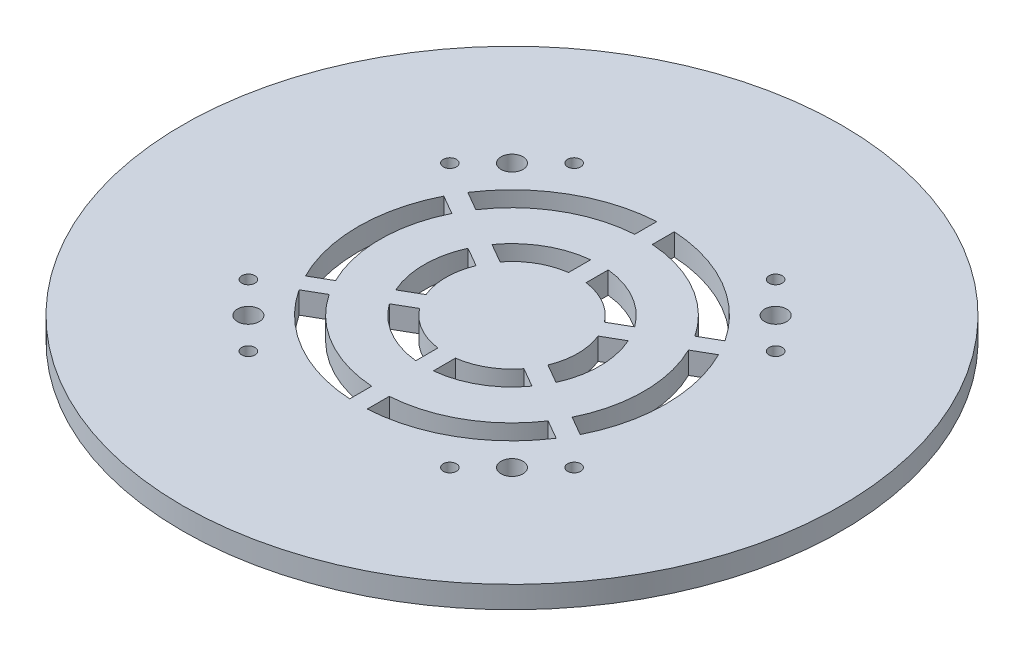
from build123d import *

# Parameters (mm, degrees)
SKETCH1_R           = 75
BOSS_EXTRUDE1_DEPTH = 5
SKETCH2_R           = 2.5
SKETCH2_R_2         = 1.5
CUT_EXTRUDE1_DEPTH  = 5
SKETCH3_R           = 35
SKETCH3_R_2         = 30
SKETCH3_R_3         = 20
SKETCH3_R_4         = 15
CUT_EXTRUDE3_DEPTH  = 5
SKETCH4_W           = 4
SKETCH4_H           = 72.786785362
BOSS_EXTRUDE2_DEPTH = 5
CIRPATTERN1_COUNT   = 6


with BuildPart() as part:
    # Sketch1 → Boss-Extrude1 (new body)
    with BuildSketch(Plane(origin=(0, 0, 0), x_dir=(1, 0, 0), z_dir=(0, 1, 0))):
        Circle(SKETCH1_R)
    extrude(amount=BOSS_EXTRUDE1_DEPTH)

    # Sketch2 → Cut-Extrude1 (cut)
    with BuildSketch(Plane(origin=(0, 5, 0), x_dir=(1, 0, 0), z_dir=(0, 1, 0))):
        with Locations((-29.999005192, 29.999005192)):
            Circle(SKETCH2_R)
        with Locations((29.999005192, 29.999005192)):
            Circle(SKETCH2_R)
        with Locations((29.999005192, -29.999005192)):
            Circle(SKETCH2_R)
        with Locations((-29.999005192, -29.999005192)):
            Circle(SKETCH2_R)
        with Locations((-22.92793738, 37.070073004)):
            Circle(SKETCH2_R_2)
        with Locations((-37.070073004, 22.92793738)):
            Circle(SKETCH2_R_2)
        with Locations((22.92793738, 37.070073004)):
            Circle(SKETCH2_R_2)
        with Locations((37.070073004, 22.92793738)):
            Circle(SKETCH2_R_2)
        with Locations((-37.070073004, -22.92793738)):
            Circle(SKETCH2_R_2)
        with Locations((-22.92793738, -37.070073004)):
            Circle(SKETCH2_R_2)
        with Locations((22.92793738, -37.070073004)):
            Circle(SKETCH2_R_2)
        with Locations((37.070073004, -22.92793738)):
            Circle(SKETCH2_R_2)
    extrude(amount=-CUT_EXTRUDE1_DEPTH, mode=Mode.SUBTRACT)

    # Sketch3 → Cut-Extrude3 (cut)
    # profile 1 of 2: a face of its own
    with BuildSketch(Plane(origin=(0, 5, 0), x_dir=(1, 0, 0), z_dir=(0, 1, 0))):
        Circle(SKETCH3_R)
        Circle(SKETCH3_R_2, mode=Mode.SUBTRACT)
    # profile 2 of 2: a face of its own
    with BuildSketch(Plane(origin=(0, 5, 0), x_dir=(1, 0, 0), z_dir=(0, 1, 0))):
        Circle(SKETCH3_R_3)
        Circle(SKETCH3_R_4, mode=Mode.SUBTRACT)
    extrude(amount=-CUT_EXTRUDE3_DEPTH, mode=Mode.SUBTRACT)


with BuildPart() as cut_extrude3_piece_1:
    # of the separate pieces the step leaves, piece 1, a body of its own (cut_extrude3_pieces)
    add(part.part.solids().sort_by_distance((75, 0, 0))[0])



with BuildPart() as cut_extrude3_piece_2:
    # of the separate pieces the step leaves, piece 2, a body of its own (cut_extrude3_pieces)
    add(part.part.solids().sort_by_distance((30, 0, 0))[0])


with BuildPart() as cut_extrude3_piece_3:
    # of the separate pieces the step leaves, piece 3, a body of its own (cut_extrude3_pieces)
    add(part.part.solids().sort_by_distance((15, 0, 0))[0])


with BuildPart() as cut_extrude3_piece_1_1:
    add(cut_extrude3_piece_1.part)

    add(cut_extrude3_piece_2.part)  # Boss-Extrude2 merges Cut-Extrude3 piece 2

    add(cut_extrude3_piece_3.part)  # Boss-Extrude2 merges Cut-Extrude3 piece 3
    # Sketch4 → Boss-Extrude2 (add)
    with BuildSketch(Plane(origin=(0, 5, 0), x_dir=(1, 0, 0), z_dir=(0, 1, 0))):
        Rectangle(SKETCH4_W, SKETCH4_H)
    boss_extrude2 = extrude(amount=-BOSS_EXTRUDE2_DEPTH)

    # CirPattern1: Boss-Extrude2 ×6 about axis
    cirpattern1_axis = Axis((0, 5, 0), (0, 1, 0))
    for i in range(1, CIRPATTERN1_COUNT):
        add(boss_extrude2.rotate(cirpattern1_axis, i * 360 / CIRPATTERN1_COUNT))


solid = cut_extrude3_piece_1_1.part
